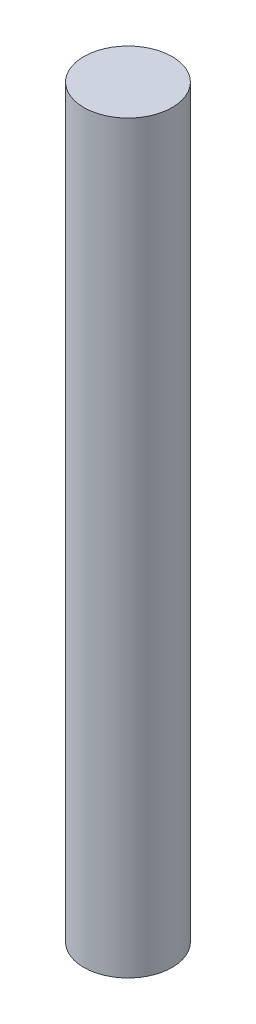
from build123d import *

# Parameters (mm, degrees)
SKETCH1_R           = 3
BOSS_EXTRUDE1_DEPTH = 50.6


with BuildPart() as part:
    # Sketch1 → Boss-Extrude1 (new body)
    with BuildSketch(Plane(origin=(0, 0, 0), x_dir=(1, 0, 0), z_dir=(0, 1, 0))):
        with Locations(Location((0, 0, 0), (0, 0, 270))):
            Circle(SKETCH1_R)
    extrude(amount=BOSS_EXTRUDE1_DEPTH)


solid = part.part
